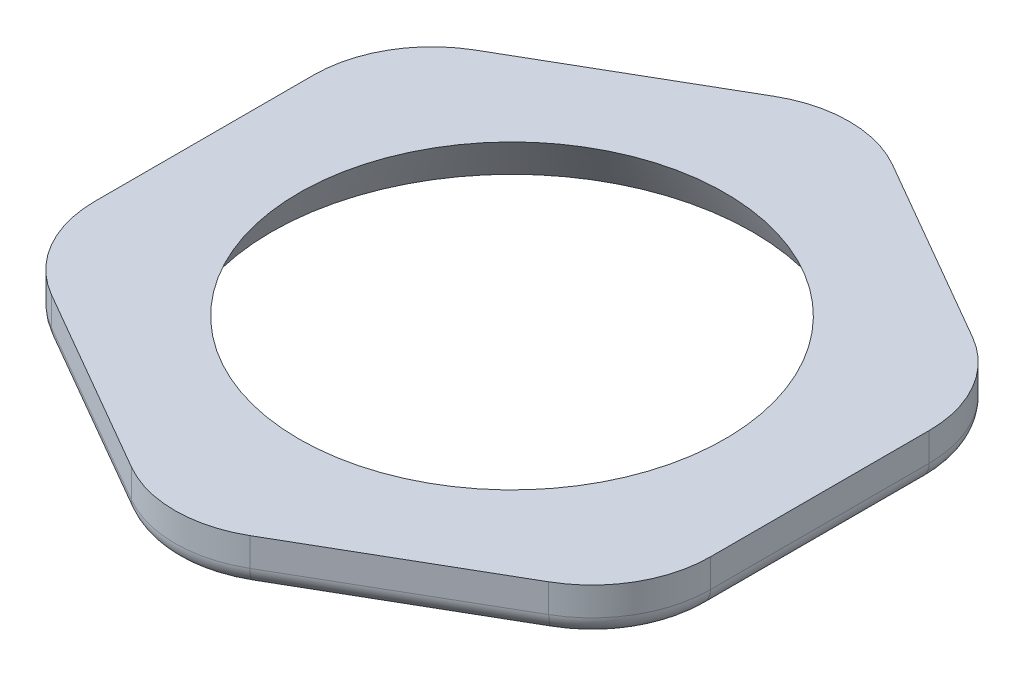
from build123d import *

# Parameters (mm, degrees)
SKETCH1_R           = 4.5
BOSS_EXTRUDE1_DEPTH = 1
SKETCH5_R           = 4.5
CUT_EXTRUDE1_DEPTH  = 1
CUT_EXTRUDE1_DRAFT  = 30
FILLET2_R           = 0.4


with BuildPart() as part:
    # Sketch1 → Boss-Extrude1 (new body)
    with BuildSketch(Plane(origin=(0, 0, 0), x_dir=(1, 0, 0), z_dir=(0, 1, 0))):
        with BuildLine():
            Line((6.5, -2.309401077), (6.5, 2.309401077))
            ThreePointArc((6.5, 2.309401077), (6.165063509, 3.559401077), (5.25, 4.474464586))
            Line((5.25, 4.474464586), (1.25, 6.783865663))
            ThreePointArc((1.25, 6.783865663), (0, 7.118802154), (-1.25, 6.783865663))
            Line((-1.25, 6.783865663), (-5.25, 4.474464586))
            ThreePointArc((-5.25, 4.474464586), (-6.165063509, 3.559401077), (-6.5, 2.309401077))
            Line((-6.5, 2.309401077), (-6.5, -2.309401077))
            ThreePointArc((-6.5, -2.309401077), (-6.165063509, -3.559401077), (-5.25, -4.474464586))
            Line((-5.25, -4.474464586), (-1.25, -6.783865663))
            ThreePointArc((-1.25, -6.783865663), (0, -7.118802154), (1.25, -6.783865663))
            Line((1.25, -6.783865663), (5.25, -4.474464586))
            ThreePointArc((5.25, -4.474464586), (6.165063509, -3.559401077), (6.5, -2.309401077))
        make_face()
        Circle(SKETCH1_R, mode=Mode.SUBTRACT)
    extrude(amount=BOSS_EXTRUDE1_DEPTH)


with BuildPart() as cut_extrude1_tool:
    # Sketch5 → Cut-Extrude1 (with draft: the straight prism first)
    with BuildSketch(Plane(origin=(0, 1, 0), x_dir=(1, 0, 0), z_dir=(0, 1, 0))):
        Circle(SKETCH5_R)
    extrude(amount=-CUT_EXTRUDE1_DEPTH)
    # Cut-Extrude1: the draft: its side faces are tilted about the plane it starts from
    cut_extrude1_sides = [cut_extrude1_tool.faces().sort_by_distance(p)[0] for p in [
        (-4.5, 0.5, 0),
    ]]
    draft(cut_extrude1_sides, Plane(origin=(0, 1, 0), x_dir=(1, 0, 0), z_dir=(0, 1, 0)), CUT_EXTRUDE1_DRAFT)


with BuildPart() as part_1:
    add(part.part)

    # Cut-Extrude1: cut by cut_extrude1_tool
    add(cut_extrude1_tool.part, mode=Mode.SUBTRACT)

    # Fillet2
    fillet2_edges = [part_1.edges().sort_by_distance(p)[0] for p in [
        (6.165063509, 0, 3.559401077),
        (3.25, 0, 5.629165125),
        (0, 0, 7.118802154),
        (-3.25, 0, 5.629165125),
        (-6.165063509, 0, 3.559401077),
        (-6.5, 0, 0),
        (-6.165063509, 0, -3.559401077),
        (-3.25, 0, -5.629165125),
        (0, 0, -7.118802154),
        (3.25, 0, -5.629165125),
        (6.165063509, 0, -3.559401077),
        (6.5, 0, 0),
    ]]
    fillet(fillet2_edges, radius=FILLET2_R)


solid = part_1.part
